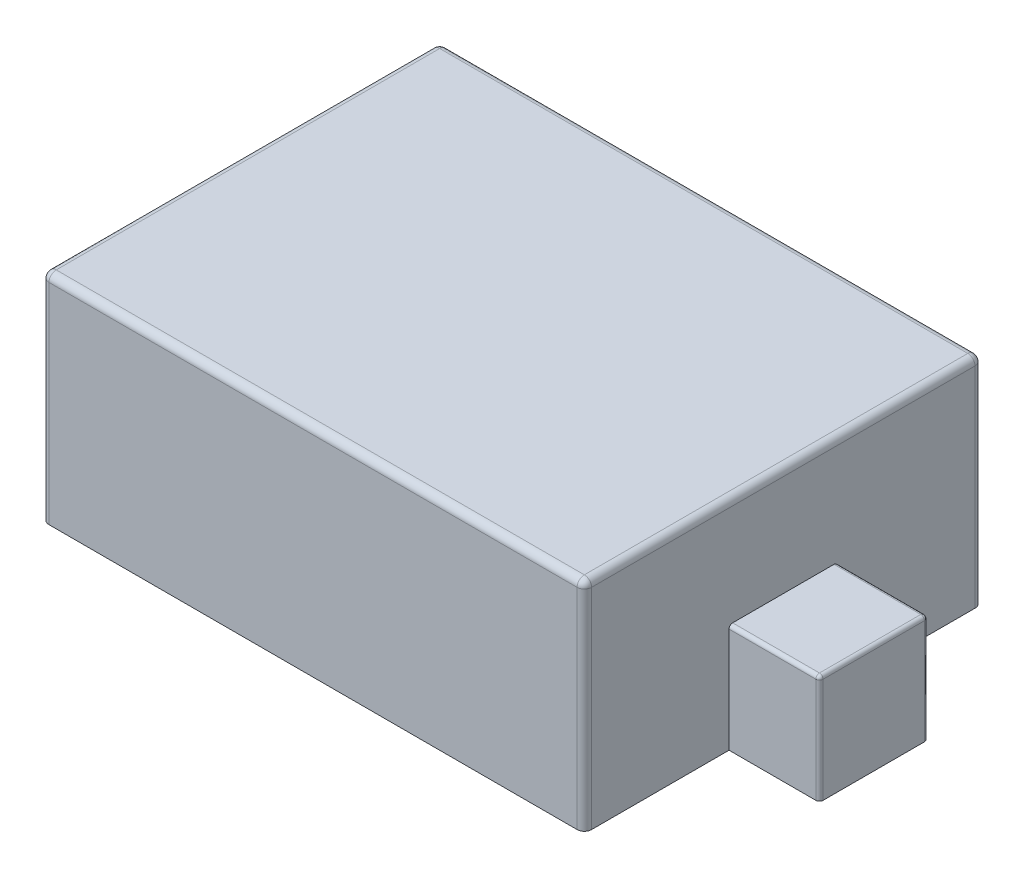
from build123d import *

# Parameters (mm, degrees)
BOSS_EXTRUDE1_DEPTH = 0.3
FILLET1_R           = 0.02
SKETCH2_W           = 0.25
SKETCH2_H           = 0.3
BOSS_EXTRUDE2_DEPTH = 0.3
FILLET2_R           = 0.01


with BuildPart() as part:
    # Sketch1 → Boss-Extrude1 (new, symmetric)
    with BuildSketch(Plane(origin=(0, 0, 0), x_dir=(1, 0, 0), z_dir=(0, 1, 0))):
        with BuildLine():
            Line((-0.73, -0.55), (0.73, -0.55))
            ThreePointArc((0.73, -0.55), (0.744142136, -0.544142136), (0.75, -0.53))
            Line((0.75, -0.53), (0.75, 0.53))
            ThreePointArc((0.75, 0.53), (0.744142136, 0.544142136), (0.73, 0.55))
            Line((0.73, 0.55), (-0.73, 0.55))
            ThreePointArc((-0.73, 0.55), (-0.744142136, 0.544142136), (-0.75, 0.53))
            Line((-0.75, 0.53), (-0.75, -0.53))
            ThreePointArc((-0.75, -0.53), (-0.744142136, -0.544142136), (-0.73, -0.55))
        make_face()
    extrude(amount=BOSS_EXTRUDE1_DEPTH, both=True)

    # Fillet1
    fillet1_edges = [part.edges().sort_by_distance(p)[0] for p in [
        (0.744142136, 0.3, 0.544142136),
        (0.75, 0.3, 0),
        (0.744142136, 0.3, -0.544142136),
        (0, 0.3, -0.55),
        (-0.744142136, 0.3, -0.544142136),
        (-0.75, 0.3, 0),
        (-0.744142136, 0.3, 0.544142136),
        (0, 0.3, 0.55),
    ]]
    fillet(fillet1_edges, radius=FILLET1_R)

    # Sketch2 → Boss-Extrude2 (add)
    with BuildSketch(Plane.XZ.offset(0.3)):
        with Locations((-0.875, 0)):
            Rectangle(SKETCH2_W, SKETCH2_H)
        with Locations((0.875, 0)):
            Rectangle(SKETCH2_W, SKETCH2_H)
    extrude(amount=-BOSS_EXTRUDE2_DEPTH)

    # Fillet2
    fillet2_edges = [part.edges().sort_by_distance(p)[0] for p in [
        (-0.875, 0, -0.15),
        (-1, 0, 0),
        (-1, -0.15, -0.15),
        (-0.875, 0, 0.15),
        (-1, -0.15, 0.15),
        (0.875, 0, 0.15),
        (1, 0, 0),
        (1, -0.15, 0.15),
        (0.875, 0, -0.15),
        (1, -0.15, -0.15),
    ]]
    fillet(fillet2_edges, radius=FILLET2_R)


solid = part.part
